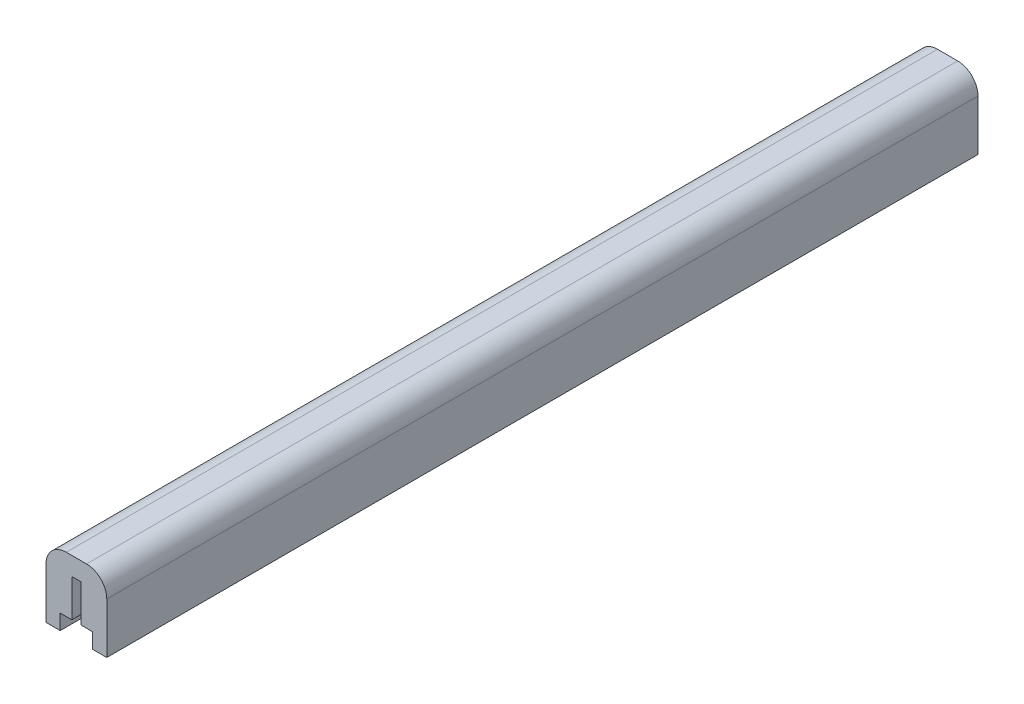
from build123d import *

# Parameters (mm, degrees)
BOSS_EXTRU_1_DEPTH = 430


with BuildPart() as part:
    # Esquisse2 → Boss.-Extru.1 (new body)
    with BuildSketch(Plane.XY):
        with BuildLine():
            Line((-15, 0), (-15, 25))
            ThreePointArc((-15, 25), (-12.071067812, 32.071067812), (-5, 35))
            Line((-5, 35), (5, 35))
            ThreePointArc((5, 35), (12.071067812, 32.071067812), (15, 25))
            Line((15, 25), (15, 0))
            Line((15, 0), (8, 0))
            Line((8, 0), (8, 7.5))
            Line((8, 7.5), (2.25, 7.5))
            Line((2.25, 7.5), (2.25, 26))
            Line((2.25, 26), (-2.25, 26))
            Line((-2.25, 26), (-2.25, 7.5))
            Line((-2.25, 7.5), (-8, 7.5))
            Line((-8, 7.5), (-8, 0))
            Line((-8, 0), (-15, 0))
        make_face()
    extrude(amount=BOSS_EXTRU_1_DEPTH)


solid = part.part
